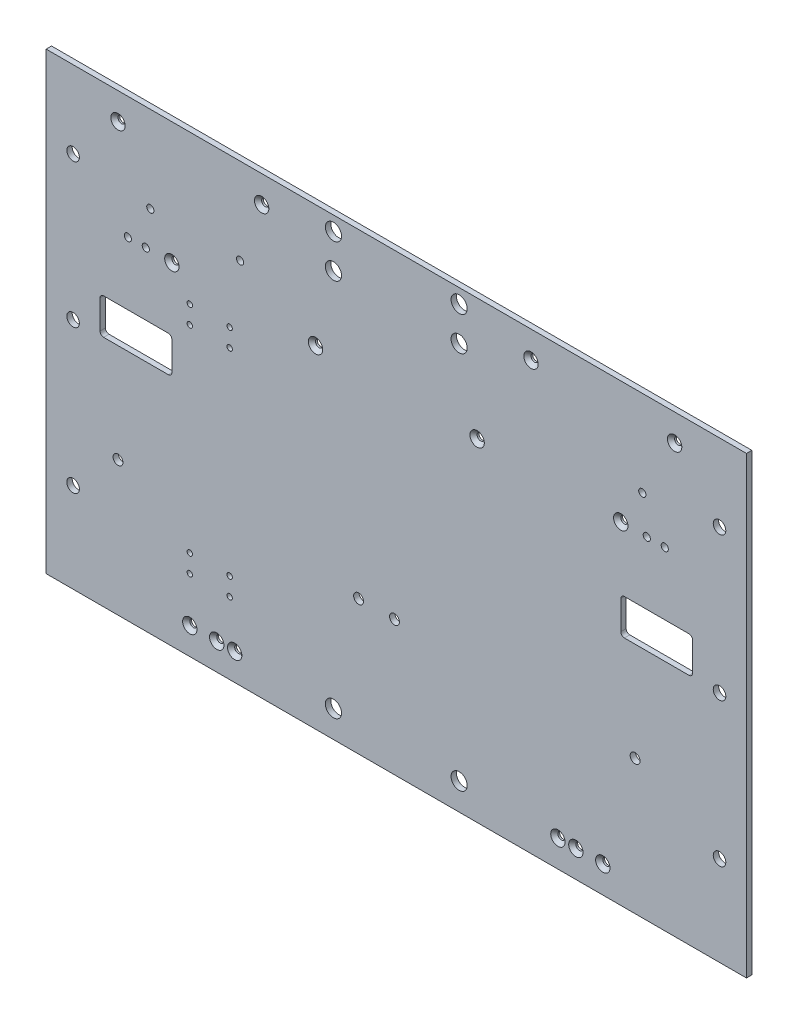
from build123d import *

# Parameters (mm, degrees)
SKETCH_1_W          = 390
SKETCH_1_H          = 253
EXTRUDE_1_DEPTH     = 3
SKETCH_3_R          = 4.5
SKETCH_3_R_2        = 3.5
SKETCH_3_R_3        = 2.75
SKETCH_3_R_4        = 2
SKETCH_3_R_5        = 1.5
CUT_EXTRUDE_3_DEPTH = 233.456985268
SKETCH_5_W          = 40
SKETCH_5_H          = 20
CUT_EXTRUDE_4_DEPTH = 233.456985268
FILLET_1_R          = 2
CHAMFER_1_SIZE      = 2


with BuildPart() as part:
    # 草图1 → 凸台-拉伸1 (new body)
    with BuildSketch(Plane.XY):
        Rectangle(SKETCH_1_W, SKETCH_1_H)
    extrude(amount=EXTRUDE_1_DEPTH)

    # 草图3 → 切除-拉伸3 (cut, through all)
    with BuildSketch(Plane.XY):
        with Locations((-35, -111.5)):
            Circle(SKETCH_3_R)
        with Locations((35, -111.5)):
            Circle(SKETCH_3_R)
        with Locations((-180, -76.5)):
            Circle(SKETCH_3_R_2)
        with Locations(Location((180, -76.5, 0), (0, 0, 180))):
            Circle(SKETCH_3_R_2)
        with Locations((-35, 118.5)):
            Circle(SKETCH_3_R)
        with Locations(Location((35, 118.5, 0), (0, 0, 180))):
            Circle(SKETCH_3_R)
        with Locations((-35, 99.5)):
            Circle(SKETCH_3_R)
        with Locations(Location((35, 99.5, 0), (0, 0, 180))):
            Circle(SKETCH_3_R)
        with Locations((-155, -51.5)):
            Circle(SKETCH_3_R_3)
        with Locations((-21, -51.5)):
            Circle(SKETCH_3_R_3)
        with Locations((-1, -51.5)):
            Circle(SKETCH_3_R_3)
        with Locations((133, -51.5)):
            Circle(SKETCH_3_R_3)
        with Locations((-149.5, 58.5)):
            Circle(SKETCH_3_R_4)
        with Locations((-139.5, 58.5)):
            Circle(SKETCH_3_R_4)
        with Locations(Location((139.5, 58.5, 0), (0, 0, 180))):
            Circle(SKETCH_3_R_4)
        with Locations(Location((149.5, 58.5, 0), (0, 0, 180))):
            Circle(SKETCH_3_R_4)
        with Locations((-137, 78.5)):
            Circle(SKETCH_3_R_4)
        with Locations((-87, 78.5)):
            Circle(SKETCH_3_R_4)
        with Locations((-180, 3.5)):
            Circle(SKETCH_3_R_2)
        with Locations((-180, 83.5)):
            Circle(SKETCH_3_R_2)
        with Locations(Location((180, 83.5, 0), (0, 0, 180))):
            Circle(SKETCH_3_R_2)
        with Locations(Location((180, 3.5, 0), (0, 0, 180))):
            Circle(SKETCH_3_R_2)
        with Locations((-155, 111.5)):
            Circle(SKETCH_3_R_4)
        with Locations((-75, 111.5)):
            Circle(SKETCH_3_R_4)
        with Locations((-45, 58.5)):
            Circle(SKETCH_3_R_4)
        with Locations((-125, 58.5)):
            Circle(SKETCH_3_R_4)
        with Locations(Location((45, 58.5, 0), (0, 0, 180))):
            Circle(SKETCH_3_R_4)
        with Locations(Location((137, 78.5, 0), (0, 0, 180))):
            Circle(SKETCH_3_R_4)
        with Locations(Location((75, 111.5, 0), (0, 0, 180))):
            Circle(SKETCH_3_R_4)
        with Locations(Location((155, 111.5, 0), (0, 0, 180))):
            Circle(SKETCH_3_R_4)
        with Locations((-115, -111.5)):
            Circle(SKETCH_3_R_4)
        with Locations(Location((115, -111.5, 0), (0, 0, 180))):
            Circle(SKETCH_3_R_4)
        with Locations(Location((125, 58.5, 0), (0, 0, 180))):
            Circle(SKETCH_3_R_4)
        with Locations((-100, -111.5)):
            Circle(SKETCH_3_R_4)
        with Locations((-90, -111.5)):
            Circle(SKETCH_3_R_4)
        with Locations(Location((90, -111.5, 0), (0, 0, 180))):
            Circle(SKETCH_3_R_4)
        with Locations(Location((100, -111.5, 0), (0, 0, 180))):
            Circle(SKETCH_3_R_4)
        with Locations((-115, 33.5)):
            Circle(SKETCH_3_R_5)
        with Locations((-92.8, 43.5)):
            Circle(SKETCH_3_R_5)
        with Locations((-115, 43.5)):
            Circle(SKETCH_3_R_5)
        with Locations((-92.8, 33.5)):
            Circle(SKETCH_3_R_5)
        with Locations((-115, -86.5)):
            Circle(SKETCH_3_R_5)
        with Locations((-92.8, -76.5)):
            Circle(SKETCH_3_R_5)
        with Locations((-115, -76.5)):
            Circle(SKETCH_3_R_5)
        with Locations((-92.8, -86.5)):
            Circle(SKETCH_3_R_5)
    extrude(amount=CUT_EXTRUDE_3_DEPTH, mode=Mode.SUBTRACT)

    # 草图5 → 切除-拉伸4 (cut, through all)
    with BuildSketch(Plane.XY):
        with Locations((-145, 13.5)):
            Rectangle(SKETCH_5_W, SKETCH_5_H)
        with Locations((145, 13.5)):
            Rectangle(SKETCH_5_W, SKETCH_5_H)
    extrude(amount=CUT_EXTRUDE_4_DEPTH, mode=Mode.SUBTRACT)

    # 圆角1
    fillet_1_edges = [part.edges().sort_by_distance(p)[0] for p in [
        (-165, 23.5, 1.5),
        (-165, 3.5, 1.5),
        (-125, 3.5, 1.5),
        (-125, 23.5, 1.5),
        (165, 23.5, 1.5),
        (125, 23.5, 1.5),
        (125, 3.5, 1.5),
        (165, 3.5, 1.5),
    ]]
    fillet(fillet_1_edges, radius=FILLET_1_R)

    # 倒角1
    chamfer_1_edges = [part.edges().sort_by_distance(p)[0] for p in [
        (92, -111.5, 3),
        (-92, -111.5, 3),
        (127, 58.5, 3),
        (102, -111.5, 3),
        (-77, 111.5, 3),
        (-157, 111.5, 3),
        (-47, 58.5, 3),
        (-102, -111.5, 3),
        (-117, -111.5, 3),
        (157, 111.5, 3),
        (77, 111.5, 3),
        (-127, 58.5, 3),
        (117, -111.5, 3),
        (47, 58.5, 3),
    ]]
    chamfer(chamfer_1_edges, length=CHAMFER_1_SIZE)


solid = part.part
